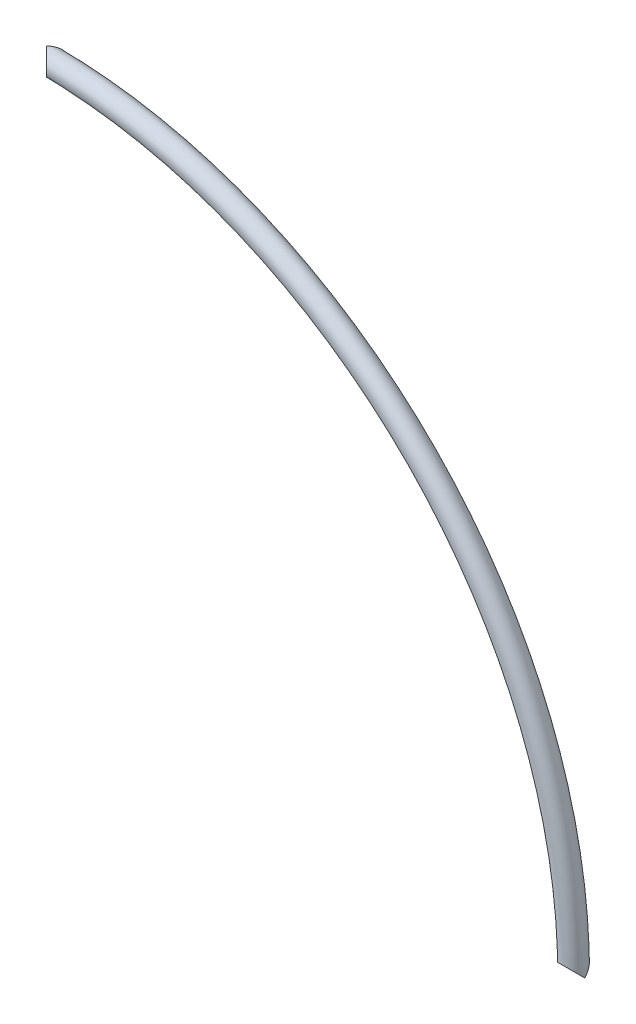
from build123d import *

# Parameters (mm, degrees)
SKETCH2_R          = 10.668
SKETCH2_R_2        = 7.8994
CUT_EXTRUDE2_DEPTH = 723.272399361
CUT_EXTRUDE4_START = 489.220558
CUT_EXTRUDE4_DEPTH = 21.447442


with BuildPart() as part:
    # Sweep1: sweep along a path in Sketch1
    with BuildLine(Plane.XY) as sweep1_path:
        ThreePointArc((0, 500), (353.553390593, 353.553390593), (500, 0))
    # Sketch2 → Sweep1 (sweep)
    with BuildSketch(Plane(origin=(0, 0, 0), x_dir=(1, 0, 0), z_dir=(0, 1, 0))):
        with Locations((500, 0)):
            Circle(SKETCH2_R)
        with Locations((500, 0)):
            Circle(SKETCH2_R_2, mode=Mode.SUBTRACT)
    sweep(path=sweep1_path.line)

    # Sketch4 → Cut-Extrude2 (cut, through all)
    with BuildSketch(Plane(origin=(0, 0, 0), x_dir=(0, 0, -1), z_dir=(1, 0, 0))):
        Polygon((0, 0), (-10.668, 10.668), (-10.668, -2.04612568), (10.668, -2.04612568), (10.668, 10.668), align=None)
    extrude(amount=CUT_EXTRUDE2_DEPTH, mode=Mode.SUBTRACT)

    # Sketch3 → Cut-Extrude4 (cut)
    with BuildSketch(Plane(origin=(0, 0, 0), x_dir=(1, 0, 0), z_dir=(0, 1, 0)).offset(CUT_EXTRUDE4_START)):
        Polygon((0, 0), (10.668, 10.668), (-11.575334071, 10.668), (-11.575334071, -10.668), (10.668, -10.668), align=None)
    extrude(amount=CUT_EXTRUDE4_DEPTH, mode=Mode.SUBTRACT)


solid = part.part
